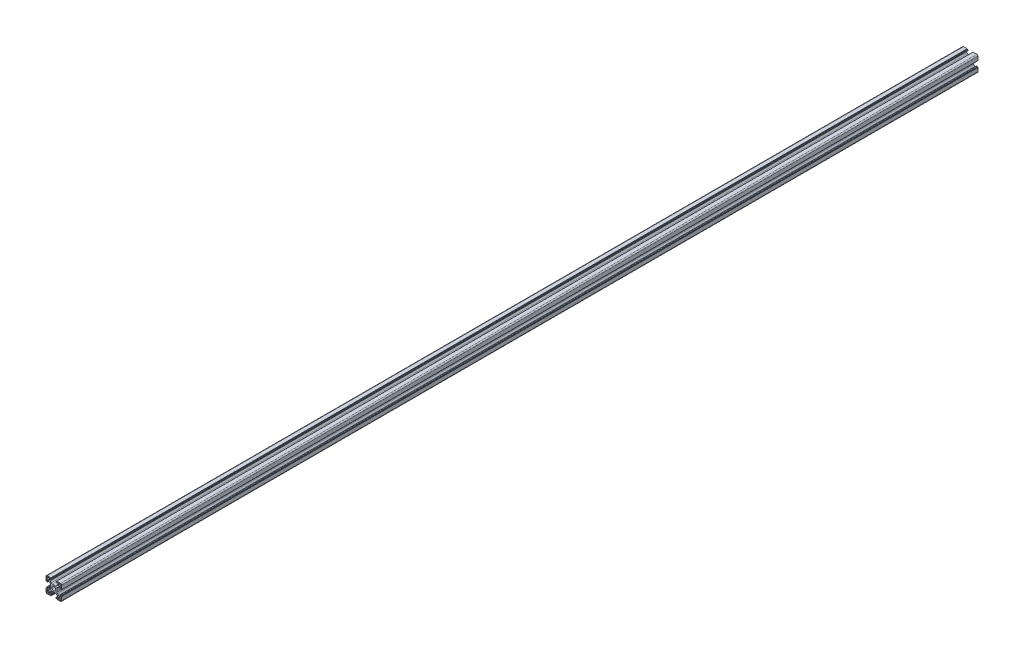
from build123d import *

# Parameters (mm, degrees)
EXTRUDE_1_DEPTH = 1175


with BuildPart() as part:
    # Эскиз1 → Бобышка-Вытянуть1 (new body)
    with BuildSketch(Plane.XY):
        with BuildLine():
            Line((-31.105150957, 65.209647948), (-29.206370287, 65.209647948))
            ThreePointArc((-29.206370287, 65.209647948), (-28.441003423, 65.361888883), (-27.792156725, 65.795434385))
            Line((-27.792156725, 65.795434385), (-26.490937394, 67.096653716))
            ThreePointArc((-26.490937394, 67.096653716), (-26.057391892, 67.745500414), (-25.905150957, 68.510867279))
            Line((-25.905150957, 68.510867279), (-25.905150957, 69.409647948))
            ThreePointArc((-25.905150957, 69.409647948), (-26.051597566, 69.763201338), (-26.405150957, 69.909647948))
            Line((-26.405150957, 69.909647948), (-26.508044175, 69.909647948))
            ThreePointArc((-26.508044175, 69.909647948), (-26.699385892, 69.871587714), (-26.861597566, 69.763201338))
            Line((-26.861597566, 69.763201338), (-27.341927652, 69.282871252))
            ThreePointArc((-27.341927652, 69.282871252), (-27.423033489, 69.228678065), (-27.518704347, 69.209647948))
            Line((-27.518704347, 69.209647948), (-27.805150957, 69.209647948))
            ThreePointArc((-27.805150957, 69.209647948), (-27.981927652, 69.282871252), (-28.055150957, 69.459647948))
            Line((-28.055150957, 69.459647948), (-28.055150957, 70.608718768))
            ThreePointArc((-28.055150957, 70.608718768), (-28.011216974, 70.714784785), (-27.905150957, 70.758718768))
            Line((-27.905150957, 70.758718768), (-27.405150957, 70.758718768))
            Line((-27.405150957, 70.758718768), (-27.405150957, 71.059647948))
            ThreePointArc((-27.405150957, 71.059647948), (-27.361216974, 71.165713965), (-27.255150957, 71.209647948))
            Line((-27.255150957, 71.209647948), (-22.605150957, 71.209647948))
            ThreePointArc((-22.605150957, 71.209647948), (-21.544490785, 70.770308119), (-21.105150957, 69.709647948))
            Line((-21.105150957, 69.709647948), (-21.105150957, 65.059647948))
            ThreePointArc((-21.105150957, 65.059647948), (-21.149084939, 64.953581931), (-21.255150957, 64.909647948))
            Line((-21.255150957, 64.909647948), (-21.556080136, 64.909647948))
            Line((-21.556080136, 64.909647948), (-21.556080136, 64.409647948))
            ThreePointArc((-21.556080136, 64.409647948), (-21.600014119, 64.303581931), (-21.706080136, 64.259647948))
            Line((-21.706080136, 64.259647948), (-22.855150957, 64.259647948))
            ThreePointArc((-22.855150957, 64.259647948), (-23.031927652, 64.332871252), (-23.105150957, 64.509647948))
            Line((-23.105150957, 64.509647948), (-23.105150957, 64.796094557))
            ThreePointArc((-23.105150957, 64.796094557), (-23.08612084, 64.891765415), (-23.031927652, 64.972871252))
            Line((-23.031927652, 64.972871252), (-22.551597566, 65.453201338))
            ThreePointArc((-22.551597566, 65.453201338), (-22.44321119, 65.615413013), (-22.405150957, 65.806754729))
            Line((-22.405150957, 65.806754729), (-22.405150957, 65.909647948))
            ThreePointArc((-22.405150957, 65.909647948), (-22.551597566, 66.263201338), (-22.905150957, 66.409647948))
            Line((-22.905150957, 66.409647948), (-23.803931626, 66.409647948))
            ThreePointArc((-23.803931626, 66.409647948), (-24.56929849, 66.257407013), (-25.218145188, 65.82386151))
            Line((-25.218145188, 65.82386151), (-26.519364519, 64.522642179))
            ThreePointArc((-26.519364519, 64.522642179), (-26.952910022, 63.873795482), (-27.105150957, 63.108428617))
            Line((-27.105150957, 63.108428617), (-27.105150957, 61.209647948))
            Line((-27.105150957, 61.209647948), (-27.105150957, 59.310867279))
            ThreePointArc((-27.105150957, 59.310867279), (-26.952910022, 58.545500414), (-26.519364519, 57.896653716))
            Line((-26.519364519, 57.896653716), (-25.218145188, 56.595434385))
            ThreePointArc((-25.218145188, 56.595434385), (-24.56929849, 56.161888883), (-23.803931626, 56.009647948))
            Line((-23.803931626, 56.009647948), (-22.905150957, 56.009647948))
            ThreePointArc((-22.905150957, 56.009647948), (-22.551597566, 56.156094557), (-22.405150957, 56.509647948))
            Line((-22.405150957, 56.509647948), (-22.405150957, 56.612541166))
            ThreePointArc((-22.405150957, 56.612541166), (-22.44321119, 56.803882883), (-22.551597566, 56.966094557))
            Line((-22.551597566, 56.966094557), (-23.031927652, 57.446424643))
            ThreePointArc((-23.031927652, 57.446424643), (-23.08612084, 57.52753048), (-23.105150957, 57.623201338))
            Line((-23.105150957, 57.623201338), (-23.105150957, 57.909647948))
            ThreePointArc((-23.105150957, 57.909647948), (-23.031927652, 58.086424643), (-22.855150957, 58.159647948))
            Line((-22.855150957, 58.159647948), (-21.706080136, 58.159647948))
            ThreePointArc((-21.706080136, 58.159647948), (-21.600014119, 58.115713965), (-21.556080136, 58.009647948))
            Line((-21.556080136, 58.009647948), (-21.556080136, 57.509647948))
            Line((-21.556080136, 57.509647948), (-21.255150957, 57.509647948))
            ThreePointArc((-21.255150957, 57.509647948), (-21.149084939, 57.465713965), (-21.105150957, 57.359647948))
            Line((-21.105150957, 57.359647948), (-21.105150957, 52.709647948))
            ThreePointArc((-21.105150957, 52.709647948), (-21.544490785, 51.648987776), (-22.605150957, 51.209647948))
            Line((-22.605150957, 51.209647948), (-27.255150957, 51.209647948))
            ThreePointArc((-27.255150957, 51.209647948), (-27.361216974, 51.253581931), (-27.405150957, 51.359647948))
            Line((-27.405150957, 51.359647948), (-27.405150957, 51.660577127))
            Line((-27.405150957, 51.660577127), (-27.905150957, 51.660577127))
            ThreePointArc((-27.905150957, 51.660577127), (-28.011216974, 51.70451111), (-28.055150957, 51.810577127))
            Line((-28.055150957, 51.810577127), (-28.055150957, 52.959647948))
            ThreePointArc((-28.055150957, 52.959647948), (-27.981927652, 53.136424643), (-27.805150957, 53.209647948))
            Line((-27.805150957, 53.209647948), (-27.518704347, 53.209647948))
            ThreePointArc((-27.518704347, 53.209647948), (-27.423033489, 53.190617831), (-27.341927652, 53.136424643))
            Line((-27.341927652, 53.136424643), (-26.861597566, 52.656094557))
            ThreePointArc((-26.861597566, 52.656094557), (-26.699385892, 52.547708181), (-26.508044175, 52.509647948))
            Line((-26.508044175, 52.509647948), (-26.405150957, 52.509647948))
            ThreePointArc((-26.405150957, 52.509647948), (-26.051597566, 52.656094557), (-25.905150957, 53.009647948))
            Line((-25.905150957, 53.009647948), (-25.905150957, 53.908428617))
            ThreePointArc((-25.905150957, 53.908428617), (-26.057391892, 54.673795482), (-26.490937394, 55.322642179))
            Line((-26.490937394, 55.322642179), (-27.792156725, 56.62386151))
            ThreePointArc((-27.792156725, 56.62386151), (-28.441003423, 57.057407013), (-29.206370287, 57.209647948))
            Line((-29.206370287, 57.209647948), (-31.105150957, 57.209647948))
            Line((-31.105150957, 57.209647948), (-33.003931626, 57.209647948))
            ThreePointArc((-33.003931626, 57.209647948), (-33.76929849, 57.057407013), (-34.418145188, 56.62386151))
            Line((-34.418145188, 56.62386151), (-35.719364519, 55.322642179))
            ThreePointArc((-35.719364519, 55.322642179), (-36.152910022, 54.673795482), (-36.305150957, 53.908428617))
            Line((-36.305150957, 53.908428617), (-36.305150957, 53.009647948))
            ThreePointArc((-36.305150957, 53.009647948), (-36.158704347, 52.656094557), (-35.805150957, 52.509647948))
            Line((-35.805150957, 52.509647948), (-35.702257738, 52.509647948))
            ThreePointArc((-35.702257738, 52.509647948), (-35.510916022, 52.547708181), (-35.348704347, 52.656094557))
            Line((-35.348704347, 52.656094557), (-34.868374261, 53.136424643))
            ThreePointArc((-34.868374261, 53.136424643), (-34.787268424, 53.190617831), (-34.691597566, 53.209647948))
            Line((-34.691597566, 53.209647948), (-34.405150957, 53.209647948))
            ThreePointArc((-34.405150957, 53.209647948), (-34.228374261, 53.136424643), (-34.155150957, 52.959647948))
            Line((-34.155150957, 52.959647948), (-34.155150957, 51.810577127))
            ThreePointArc((-34.155150957, 51.810577127), (-34.199084939, 51.70451111), (-34.305150957, 51.660577127))
            Line((-34.305150957, 51.660577127), (-34.805150957, 51.660577127))
            Line((-34.805150957, 51.660577127), (-34.805150957, 51.359647948))
            ThreePointArc((-34.805150957, 51.359647948), (-34.849084939, 51.253581931), (-34.955150957, 51.209647948))
            Line((-34.955150957, 51.209647948), (-39.605150957, 51.209647948))
            ThreePointArc((-39.605150957, 51.209647948), (-40.665811128, 51.648987776), (-41.105150957, 52.709647948))
            Line((-41.105150957, 52.709647948), (-41.105150957, 57.359647948))
            ThreePointArc((-41.105150957, 57.359647948), (-41.061216974, 57.465713965), (-40.955150957, 57.509647948))
            Line((-40.955150957, 57.509647948), (-40.654221777, 57.509647948))
            Line((-40.654221777, 57.509647948), (-40.654221777, 58.009647948))
            ThreePointArc((-40.654221777, 58.009647948), (-40.610287794, 58.115713965), (-40.504221777, 58.159647948))
            Line((-40.504221777, 58.159647948), (-39.355150957, 58.159647948))
            ThreePointArc((-39.355150957, 58.159647948), (-39.178374261, 58.086424643), (-39.105150957, 57.909647948))
            Line((-39.105150957, 57.909647948), (-39.105150957, 57.623201338))
            ThreePointArc((-39.105150957, 57.623201338), (-39.124181073, 57.52753048), (-39.178374261, 57.446424643))
            Line((-39.178374261, 57.446424643), (-39.658704347, 56.966094557))
            ThreePointArc((-39.658704347, 56.966094557), (-39.767090723, 56.803882883), (-39.805150957, 56.612541166))
            Line((-39.805150957, 56.612541166), (-39.805150957, 56.509647948))
            ThreePointArc((-39.805150957, 56.509647948), (-39.658704347, 56.156094557), (-39.305150957, 56.009647948))
            Line((-39.305150957, 56.009647948), (-38.406370287, 56.009647948))
            ThreePointArc((-38.406370287, 56.009647948), (-37.641003423, 56.161888883), (-36.992156725, 56.595434385))
            Line((-36.992156725, 56.595434385), (-35.690937394, 57.896653716))
            ThreePointArc((-35.690937394, 57.896653716), (-35.257391892, 58.545500414), (-35.105150957, 59.310867279))
            Line((-35.105150957, 59.310867279), (-35.105150957, 61.209647948))
            Line((-35.105150957, 61.209647948), (-35.105150957, 63.108428617))
            ThreePointArc((-35.105150957, 63.108428617), (-35.257391892, 63.873795482), (-35.690937394, 64.522642179))
            Line((-35.690937394, 64.522642179), (-36.992156725, 65.82386151))
            ThreePointArc((-36.992156725, 65.82386151), (-37.641003423, 66.257407013), (-38.406370287, 66.409647948))
            Line((-38.406370287, 66.409647948), (-39.305150957, 66.409647948))
            ThreePointArc((-39.305150957, 66.409647948), (-39.658704347, 66.263201338), (-39.805150957, 65.909647948))
            Line((-39.805150957, 65.909647948), (-39.805150957, 65.806754729))
            ThreePointArc((-39.805150957, 65.806754729), (-39.767090723, 65.615413013), (-39.658704347, 65.453201338))
            Line((-39.658704347, 65.453201338), (-39.178374261, 64.972871252))
            ThreePointArc((-39.178374261, 64.972871252), (-39.124181073, 64.891765415), (-39.105150957, 64.796094557))
            Line((-39.105150957, 64.796094557), (-39.105150957, 64.509647948))
            ThreePointArc((-39.105150957, 64.509647948), (-39.178374261, 64.332871252), (-39.355150957, 64.259647948))
            Line((-39.355150957, 64.259647948), (-40.504221777, 64.259647948))
            ThreePointArc((-40.504221777, 64.259647948), (-40.610287794, 64.303581931), (-40.654221777, 64.409647948))
            Line((-40.654221777, 64.409647948), (-40.654221777, 64.909647948))
            Line((-40.654221777, 64.909647948), (-40.955150957, 64.909647948))
            ThreePointArc((-40.955150957, 64.909647948), (-41.061216974, 64.953581931), (-41.105150957, 65.059647948))
            Line((-41.105150957, 65.059647948), (-41.105150957, 69.709647948))
            ThreePointArc((-41.105150957, 69.709647948), (-40.665811128, 70.770308119), (-39.605150957, 71.209647948))
            Line((-39.605150957, 71.209647948), (-34.955150957, 71.209647948))
            ThreePointArc((-34.955150957, 71.209647948), (-34.849084939, 71.165713965), (-34.805150957, 71.059647948))
            Line((-34.805150957, 71.059647948), (-34.805150957, 70.758718768))
            Line((-34.805150957, 70.758718768), (-34.305150957, 70.758718768))
            ThreePointArc((-34.305150957, 70.758718768), (-34.199084939, 70.714784785), (-34.155150957, 70.608718768))
            Line((-34.155150957, 70.608718768), (-34.155150957, 69.459647948))
            ThreePointArc((-34.155150957, 69.459647948), (-34.228374261, 69.282871252), (-34.405150957, 69.209647948))
            Line((-34.405150957, 69.209647948), (-34.691597566, 69.209647948))
            ThreePointArc((-34.691597566, 69.209647948), (-34.787268424, 69.228678065), (-34.868374261, 69.282871252))
            Line((-34.868374261, 69.282871252), (-35.348704347, 69.763201338))
            ThreePointArc((-35.348704347, 69.763201338), (-35.510916022, 69.871587714), (-35.702257738, 69.909647948))
            Line((-35.702257738, 69.909647948), (-35.805150957, 69.909647948))
            ThreePointArc((-35.805150957, 69.909647948), (-36.158704347, 69.763201338), (-36.305150957, 69.409647948))
            Line((-36.305150957, 69.409647948), (-36.305150957, 68.510867279))
            ThreePointArc((-36.305150957, 68.510867279), (-36.152910022, 67.745500414), (-35.719364519, 67.096653716))
            Line((-35.719364519, 67.096653716), (-34.418145188, 65.795434385))
            ThreePointArc((-34.418145188, 65.795434385), (-33.76929849, 65.361888883), (-33.003931626, 65.209647948))
            Line((-33.003931626, 65.209647948), (-31.105150957, 65.209647948))
        make_face()
        with BuildLine():
            Line((-24.205150957, 67.309647948), (-22.805150957, 67.309647948))
            ThreePointArc((-22.805150957, 67.309647948), (-22.239465532, 67.543962523), (-22.005150957, 68.109647948))
            Line((-22.005150957, 68.109647948), (-22.005150957, 69.509647948))
            ThreePointArc((-22.005150957, 69.509647948), (-22.239465532, 70.075333373), (-22.805150957, 70.309647948))
            Line((-22.805150957, 70.309647948), (-24.205150957, 70.309647948))
            ThreePointArc((-24.205150957, 70.309647948), (-24.770836381, 70.075333373), (-25.005150957, 69.509647948))
            Line((-25.005150957, 69.509647948), (-25.005150957, 68.109647948))
            ThreePointArc((-25.005150957, 68.109647948), (-24.770836381, 67.543962523), (-24.205150957, 67.309647948))
        make_face(mode=Mode.SUBTRACT)
        with BuildLine():
            Line((-25.005150957, 54.309647948), (-25.005150957, 52.909647948))
            ThreePointArc((-25.005150957, 52.909647948), (-24.770836381, 52.343962523), (-24.205150957, 52.109647948))
            Line((-24.205150957, 52.109647948), (-22.805150957, 52.109647948))
            ThreePointArc((-22.805150957, 52.109647948), (-22.239465532, 52.343962523), (-22.005150957, 52.909647948))
            Line((-22.005150957, 52.909647948), (-22.005150957, 54.309647948))
            ThreePointArc((-22.005150957, 54.309647948), (-22.239465532, 54.875333373), (-22.805150957, 55.109647948))
            Line((-22.805150957, 55.109647948), (-24.205150957, 55.109647948))
            ThreePointArc((-24.205150957, 55.109647948), (-24.770836381, 54.875333373), (-25.005150957, 54.309647948))
        make_face(mode=Mode.SUBTRACT)
        with BuildLine():
            Line((-38.005150957, 55.109647948), (-39.405150957, 55.109647948))
            ThreePointArc((-39.405150957, 55.109647948), (-39.970836381, 54.875333373), (-40.205150957, 54.309647948))
            Line((-40.205150957, 54.309647948), (-40.205150957, 52.909647948))
            ThreePointArc((-40.205150957, 52.909647948), (-39.970836381, 52.343962523), (-39.405150957, 52.109647948))
            Line((-39.405150957, 52.109647948), (-38.005150957, 52.109647948))
            ThreePointArc((-38.005150957, 52.109647948), (-37.439465532, 52.343962523), (-37.205150957, 52.909647948))
            Line((-37.205150957, 52.909647948), (-37.205150957, 54.309647948))
            ThreePointArc((-37.205150957, 54.309647948), (-37.439465532, 54.875333373), (-38.005150957, 55.109647948))
        make_face(mode=Mode.SUBTRACT)
        with BuildLine():
            Line((-37.205150957, 68.109647948), (-37.205150957, 69.509647948))
            ThreePointArc((-37.205150957, 69.509647948), (-37.439465532, 70.075333373), (-38.005150957, 70.309647948))
            Line((-38.005150957, 70.309647948), (-39.405150957, 70.309647948))
            ThreePointArc((-39.405150957, 70.309647948), (-39.970836381, 70.075333373), (-40.205150957, 69.509647948))
            Line((-40.205150957, 69.509647948), (-40.205150957, 68.109647948))
            ThreePointArc((-40.205150957, 68.109647948), (-39.970836381, 67.543962523), (-39.405150957, 67.309647948))
            Line((-39.405150957, 67.309647948), (-38.005150957, 67.309647948))
            ThreePointArc((-38.005150957, 67.309647948), (-37.439465532, 67.543962523), (-37.205150957, 68.109647948))
        make_face(mode=Mode.SUBTRACT)
        with BuildLine():
            ThreePointArc((-28.605150957, 61.209647948), (-29.337384004, 62.977414901), (-31.105150957, 63.709647948))
            ThreePointArc((-31.105150957, 63.709647948), (-32.87291791, 62.977414901), (-33.605150957, 61.209647948))
            ThreePointArc((-33.605150957, 61.209647948), (-32.87291791, 59.441880995), (-31.105150957, 58.709647948))
            ThreePointArc((-31.105150957, 58.709647948), (-29.337384004, 59.441880995), (-28.605150957, 61.209647948))
        make_face(mode=Mode.SUBTRACT)
    extrude(amount=EXTRUDE_1_DEPTH)


solid = part.part
